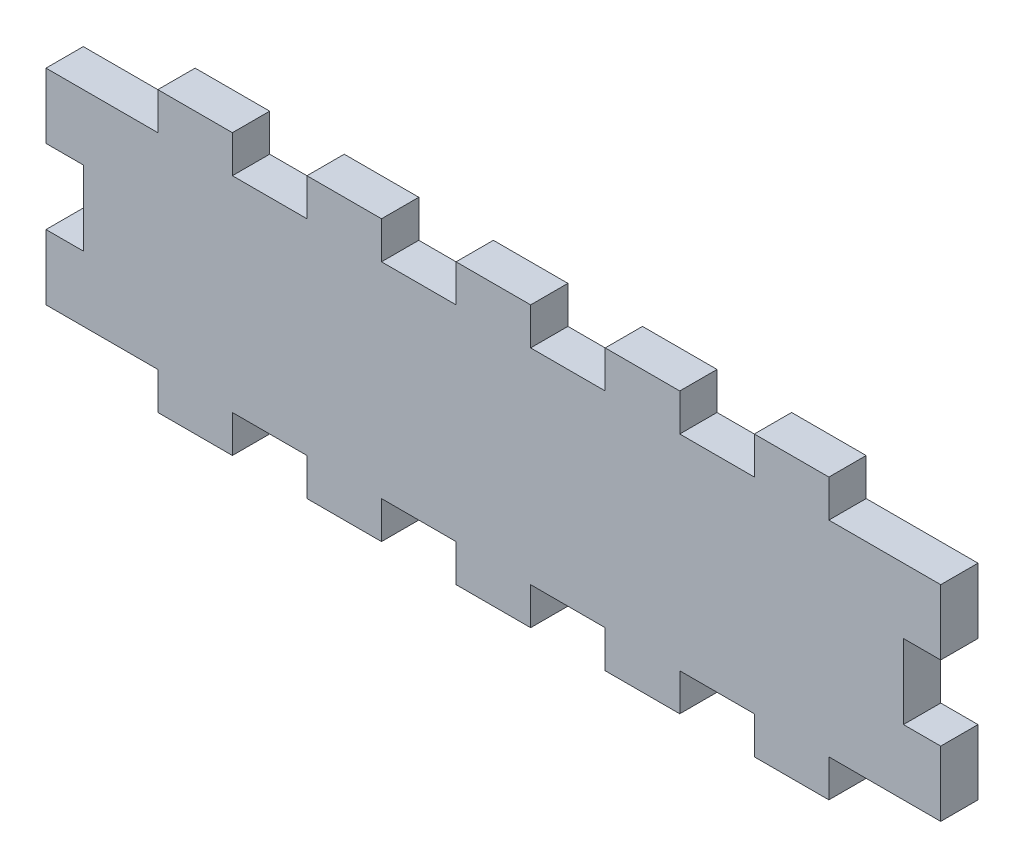
from build123d import *

# Parameters (mm, degrees)
SKETCH1_W            = 152.4
SKETCH1_H            = 34.925
MASS_DEPTH           = 6.35
SKETCH3_W            = 12.7
SKETCH3_H            = 12.7
TOP_TOOTH_DEPTH      = 6.35
TOP_PUZZLE_COUNT     = 3
TOP_PUZZLE_PITCH     = 25.4
TOP_PUZZLE_COL_COUNT = 3
TOP_PUZZLE_COL_PITCH = 25.4
SKETCH4_W            = 12.7
SKETCH4_H            = 12.7
SIDE_TOOTH_DEPTH     = 81.086188923


with BuildPart() as part:
    # Sketch1 → Mass (new body)
    with BuildSketch(Plane.XY):
        Rectangle(SKETCH1_W, SKETCH1_H)
    extrude(amount=MASS_DEPTH)

    # Sketch3 → Top Tooth (add)
    with BuildSketch(Plane(origin=(0, 0, 0), x_dir=(-1, 0, 0), z_dir=(0, 0, -1))):
        with Locations((0, 17.4625)):
            Rectangle(SKETCH3_W, SKETCH3_H)
        with Locations((0, -17.4625)):
            Rectangle(SKETCH3_W, SKETCH3_H)
    top_tooth = extrude(amount=-TOP_TOOTH_DEPTH)

    # Top Puzzle: Top Tooth ×3
    with Locations(*[(-i * TOP_PUZZLE_PITCH, 0, 0) for i in range(1, TOP_PUZZLE_COUNT)]):
        add(top_tooth)

    # Top Puzzle col: Top Tooth ×3
    with Locations(*[(i * TOP_PUZZLE_COL_PITCH, 0, 0) for i in range(1, TOP_PUZZLE_COL_COUNT)]):
        add(top_tooth)

    # Sketch4 → Side Tooth (cut, through all)
    with BuildSketch(Plane.XY.offset(6.35)):
        with Locations((76.2, 0)):
            Rectangle(SKETCH4_W, SKETCH4_H)
        with Locations((-76.2, 0)):
            Rectangle(SKETCH4_W, SKETCH4_H)
    extrude(amount=-SIDE_TOOTH_DEPTH, mode=Mode.SUBTRACT)


solid = part.part
